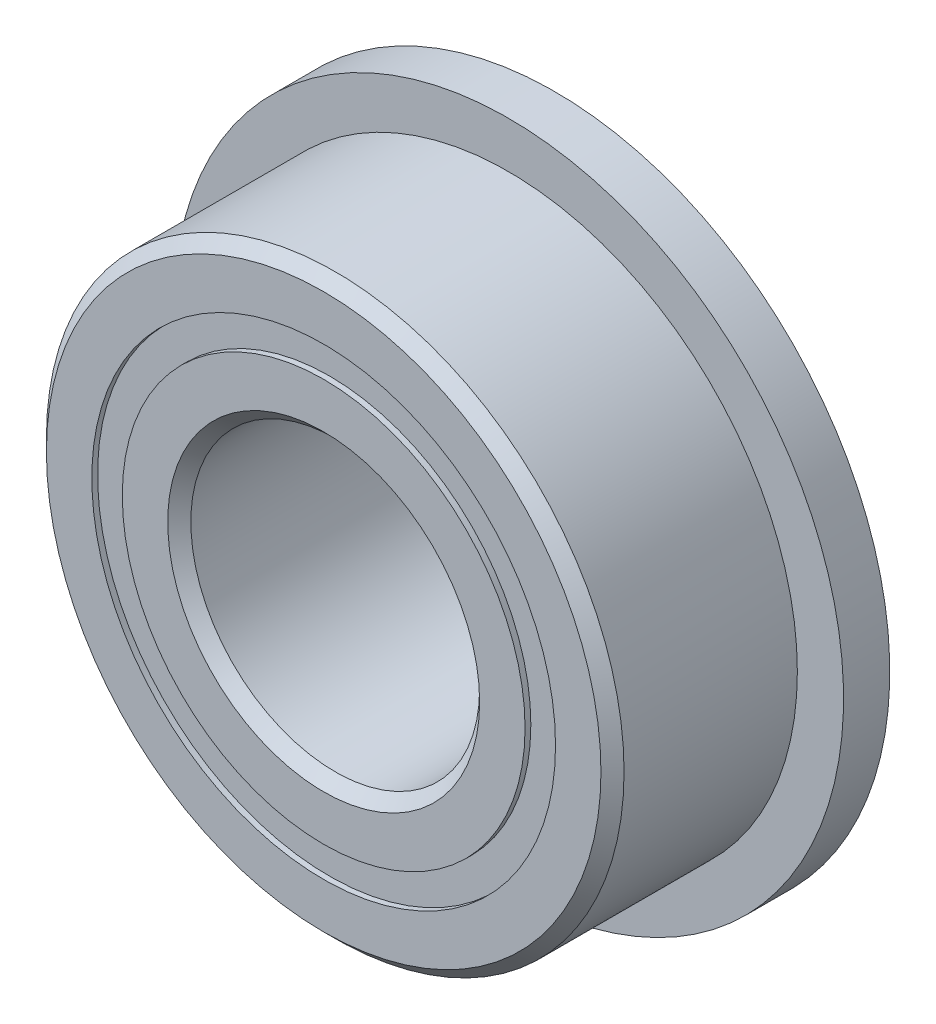
from build123d import *

# Parameters (mm, degrees)
CIRPATTERN1_COUNT = 12
SKETCH5_W         = 0.972810551
SKETCH5_H         = 0.527472528
SKETCH6_W         = 0.8
SKETCH6_H         = 1.786263736


with BuildPart() as part:
    # Sketch1 → Revolve1 (revolve)
    with BuildSketch(Plane(origin=(0, 0, 0), x_dir=(0, 0, -1), z_dir=(1, 0, 0)), mode=Mode.PRIVATE) as revolve1_sk:
        with BuildLine():
            Line((1.8, 5), (-1.8, 5))
            Line((-1.8, 5), (-2, 4.8))
            Line((-2, 4.8), (-2, 4.013736264))
            Line((-2, 4.013736264), (-0.888888889, 4.013736264))
            ThreePointArc((-0.888888889, 4.013736264), (0, 4.677189449), (0.888888889, 4.013736264))
            Line((0.888888889, 4.013736264), (2, 4.013736264))
            Line((2, 4.013736264), (2, 4.8))
            Line((2, 4.8), (1.8, 5))
        make_face()
    revolve(revolve1_sk.sketch.rotate(Axis((0, 0, 2), (0, 0, -1)), 90), axis=Axis((0, 0, 2), (0, 0, -1)))

    # Sketch6 → Revolve6 (revolve)
    with BuildSketch(Plane(origin=(0, 0, 0), x_dir=(0, 0, -1), z_dir=(1, 0, 0)), mode=Mode.PRIVATE) as revolve6_sk:
        with Locations((1.6, 4.906868132)):
            Rectangle(SKETCH6_W, SKETCH6_H)
    revolve(revolve6_sk.sketch.rotate(Axis((0, 0, -2), (0, 0, 1)), 270), axis=Axis((0, 0, -2), (0, 0, 1)))


with BuildPart() as body_2:
    # Sketch3 → Revolve3 (revolve)
    with BuildSketch(Plane(origin=(0, 0, 0), x_dir=(0, 0, -1), z_dir=(1, 0, 0)), mode=Mode.PRIVATE) as revolve3_sk:
        with BuildLine():
            Line((-2, 3.486263736), (-0.888888889, 3.486263736))
            ThreePointArc((-0.888888889, 3.486263736), (0, 2.822810551), (0.888888889, 3.486263736))
            Line((0.888888889, 3.486263736), (2, 3.486263736))
            Line((2, 3.486263736), (2, 2.7))
            Line((2, 2.7), (1.8, 2.5))
            Line((1.8, 2.5), (-1.8, 2.5))
            Line((-1.8, 2.5), (-2, 2.7))
            Line((-2, 2.7), (-2, 3.486263736))
        make_face()
    revolve(revolve3_sk.sketch.rotate(Axis((0, 0, 2), (0, 0, -1)), 90), axis=Axis((0, 0, 2), (0, 0, -1)))


with BuildPart() as body_3:
    # Sketch4 → Revolve4 (revolve)
    with BuildSketch(Plane(origin=(0, 0, 0), x_dir=(0, 0, -1), z_dir=(1, 0, 0))):
        with BuildLine():
            Line((-0.927189449, 3.75), (0.927189449, 3.75))
            ThreePointArc((0.927189449, 3.75), (0, 4.677189449), (-0.927189449, 3.75))
        make_face()
    revolve(axis=Axis((0, 3.75, 0.927189449), (0, 0, -1)))


with BuildPart() as cirpattern1_1:
    # CirPattern1: pattern copy
    add(body_3.part.rotate(Axis((0, 0, 0), (0, 0, 1)), 1 * 360 / CIRPATTERN1_COUNT))


with BuildPart() as cirpattern1_2:
    # CirPattern1: pattern copy
    add(body_3.part.rotate(Axis((0, 0, 0), (0, 0, 1)), 2 * 360 / CIRPATTERN1_COUNT))


with BuildPart() as cirpattern1_3:
    # CirPattern1: pattern copy
    add(body_3.part.rotate(Axis((0, 0, 0), (0, 0, 1)), 3 * 360 / CIRPATTERN1_COUNT))


with BuildPart() as cirpattern1_4:
    # CirPattern1: pattern copy
    add(body_3.part.rotate(Axis((0, 0, 0), (0, 0, 1)), 4 * 360 / CIRPATTERN1_COUNT))


with BuildPart() as cirpattern1_5:
    # CirPattern1: pattern copy
    add(body_3.part.rotate(Axis((0, 0, 0), (0, 0, 1)), 5 * 360 / CIRPATTERN1_COUNT))


with BuildPart() as cirpattern1_6:
    # CirPattern1: pattern copy
    add(body_3.part.rotate(Axis((0, 0, 0), (0, 0, 1)), 6 * 360 / CIRPATTERN1_COUNT))


with BuildPart() as cirpattern1_7:
    # CirPattern1: pattern copy
    add(body_3.part.rotate(Axis((0, 0, 0), (0, 0, 1)), 7 * 360 / CIRPATTERN1_COUNT))


with BuildPart() as cirpattern1_8:
    # CirPattern1: pattern copy
    add(body_3.part.rotate(Axis((0, 0, 0), (0, 0, 1)), 8 * 360 / CIRPATTERN1_COUNT))


with BuildPart() as cirpattern1_9:
    # CirPattern1: pattern copy
    add(body_3.part.rotate(Axis((0, 0, 0), (0, 0, 1)), 9 * 360 / CIRPATTERN1_COUNT))


with BuildPart() as cirpattern1_10:
    # CirPattern1: pattern copy
    add(body_3.part.rotate(Axis((0, 0, 0), (0, 0, 1)), 10 * 360 / CIRPATTERN1_COUNT))


with BuildPart() as cirpattern1_11:
    # CirPattern1: pattern copy
    add(body_3.part.rotate(Axis((0, 0, 0), (0, 0, 1)), 11 * 360 / CIRPATTERN1_COUNT))


with BuildPart() as body_15:
    # Sketch5 → Revolve5 (revolve)
    with BuildSketch(Plane(origin=(0, 0, 0), x_dir=(0, 0, -1), z_dir=(1, 0, 0)), mode=Mode.PRIVATE) as revolve5_sk:
        with Locations((-1.413594725, 3.75)):
            Rectangle(SKETCH5_W, SKETCH5_H)
        with Locations((1.413594725, 3.75)):
            Rectangle(SKETCH5_W, SKETCH5_H)
    revolve(revolve5_sk.sketch.rotate(Axis((0, 0, 2), (0, 0, -1)), 90), axis=Axis((0, 0, 2), (0, 0, -1)))


solid = Compound([part.part, body_2.part, body_3.part, cirpattern1_1.part, cirpattern1_2.part, cirpattern1_3.part, cirpattern1_4.part, cirpattern1_5.part, cirpattern1_6.part, cirpattern1_7.part, cirpattern1_8.part, cirpattern1_9.part, cirpattern1_10.part, cirpattern1_11.part, body_15.part])
